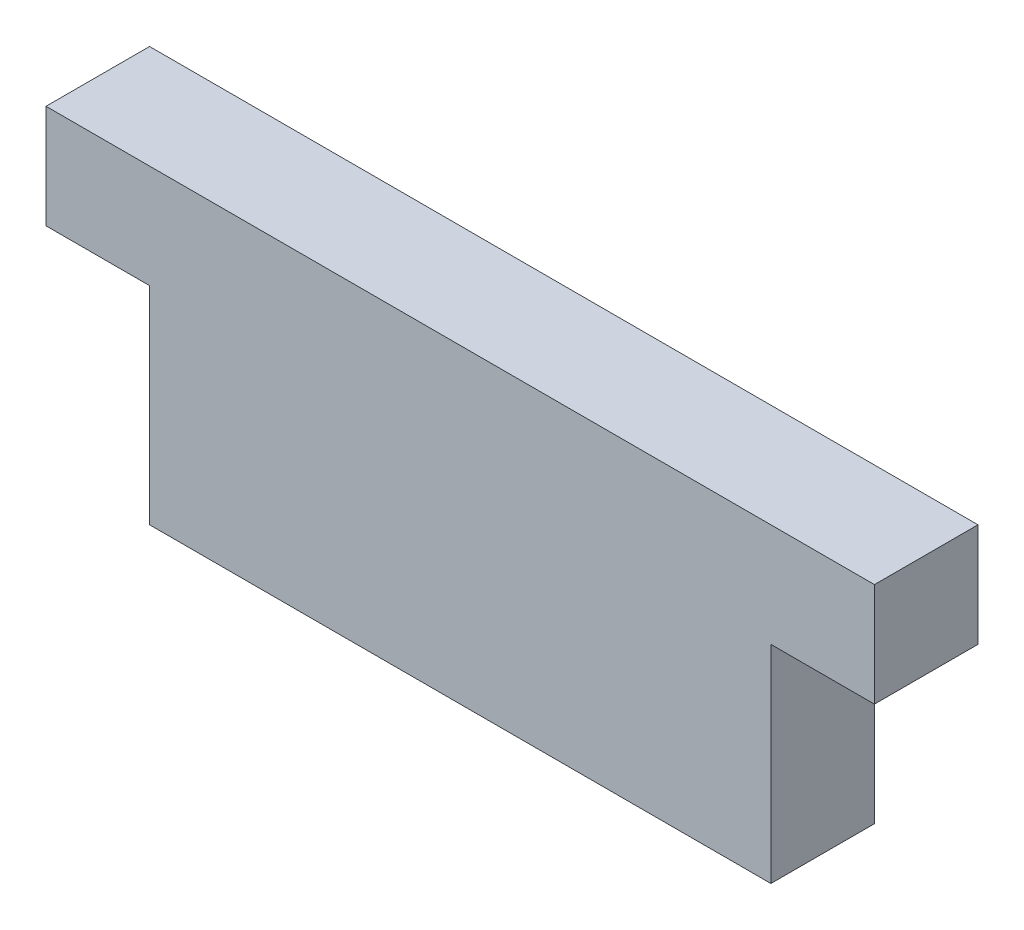
from build123d import *

# Parameters (mm, degrees)
SKETCH1_W           = 30
SKETCH1_H           = 10
BOSS_EXTRUDE1_DEPTH = 5


with BuildPart() as part:
    # Sketch1 → Boss-Extrude1 (new body)
    with BuildSketch(Plane.XY):
        with Locations((-15, -5)):
            Rectangle(SKETCH1_W, SKETCH1_H)
        Polygon((-30, 0), (0, 0), (5, 0), (5, 5), (-35, 5), (-35, 0), align=None)
    extrude(amount=BOSS_EXTRUDE1_DEPTH)


solid = part.part
